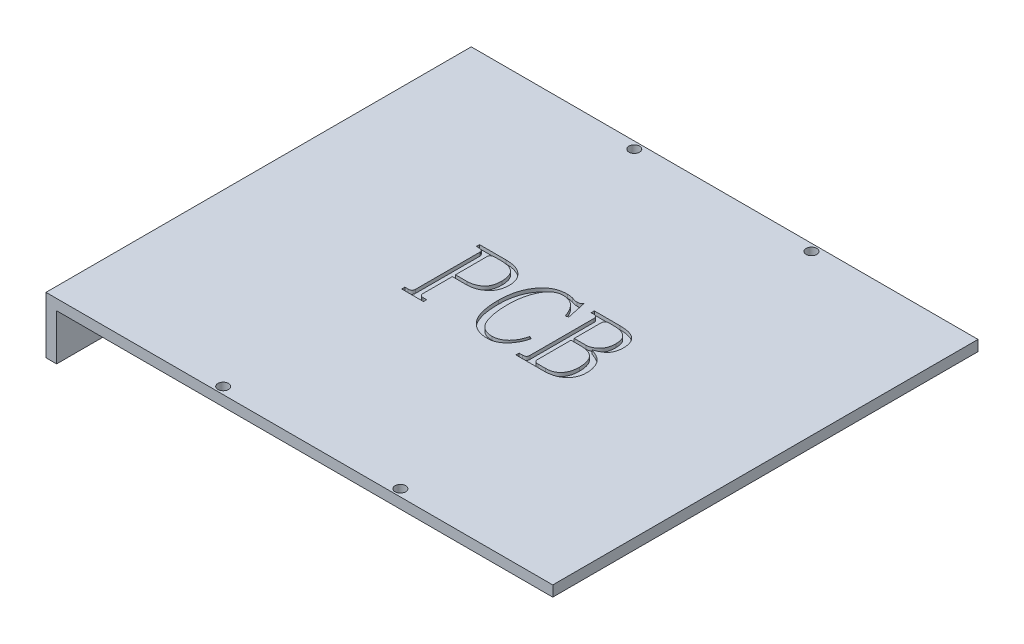
from build123d import *

# Parameters (mm, degrees)
SKETCH_1_W          = 140
SKETCH_1_H          = 120
SKETCH_1_R          = 1.5
EXTRUDE_1_DEPTH     = 3
SKETCH_2_W          = 3
SKETCH_2_H          = 120
EXTRUDE_2_DEPTH     = 16
SKETCH_3_W          = 16
SKETCH_3_H          = 1
CUT_EXTRUDE_1_DEPTH = 13
SKETCH_4_W          = 13
SKETCH_4_H          = 6.8
CUT_EXTRUDE_2_DEPTH = 13
CUT_EXTRUDE_3_DEPTH = 1


with BuildPart() as part:
    # 草图1 → 凸台-拉伸1 (new body)
    with BuildSketch(Plane(origin=(0, 0, 0), x_dir=(1, 0, 0), z_dir=(0, 1, 0))):
        with Locations((70, 60)):
            Rectangle(SKETCH_1_W, SKETCH_1_H)
        with Locations(Location((45, 118, 0), (0, 0, 270))):
            Circle(SKETCH_1_R, mode=Mode.SUBTRACT)
        with Locations(Location((95, 118, 0), (0, 0, 270))):
            Circle(SKETCH_1_R, mode=Mode.SUBTRACT)
        with Locations(Location((95, 2, 0), (0, 0, 270))):
            Circle(SKETCH_1_R, mode=Mode.SUBTRACT)
        with Locations(Location((45, 2, 0), (0, 0, 270))):
            Circle(SKETCH_1_R, mode=Mode.SUBTRACT)
    extrude(amount=EXTRUDE_1_DEPTH)

    # 草图2 → 凸台-拉伸2 (add)
    with BuildSketch(Plane(origin=(0, 3, 0), x_dir=(1, 0, 0), z_dir=(0, 1, 0))):
        with Locations((-1.5, 60)):
            Rectangle(SKETCH_2_W, SKETCH_2_H)
    extrude(amount=-EXTRUDE_2_DEPTH)

    # 草图3 → 切除-拉伸1 (cut)
    with BuildSketch(Plane.ZY.offset(3)):
        with Locations((-75, -2.75)):
            Rectangle(SKETCH_3_W, SKETCH_3_H)
    extrude(amount=-CUT_EXTRUDE_1_DEPTH, mode=Mode.SUBTRACT)

    # 草图4 → 切除-拉伸2 (cut)
    with BuildSketch(Plane(origin=(0, 0, 0), x_dir=(0, 0, -1), z_dir=(1, 0, 0))):
        with Locations((23.25, -3.4)):
            Rectangle(SKETCH_4_W, SKETCH_4_H)
    extrude(amount=-CUT_EXTRUDE_2_DEPTH, mode=Mode.SUBTRACT)

    # 草图5 → 切除-拉伸3 (cut)
    # profile 1 of 3: a face of its own
    with BuildSketch(Plane(origin=(0, 3, 0), x_dir=(1, 0, 0), z_dir=(0, 1, 0))):
        with BuildLine():
            Line((50.486114297, 61.171336776), (50.486114297, 52.901691817))
            add(Edge.make_bspline(
                [(50.486114297, 52.901691817), (50.488899739, 52.823361918), (50.494232978, 52.673384971), (50.556585686, 52.464291652), (50.65589332, 52.285718962), (50.795910233, 52.140372539), (50.971307938, 52.037503046), (51.166693275, 51.954004432), (51.387340451, 51.908587981), (51.54182874, 51.904147349), (51.621438436, 51.901859036)],
                knots=[0, 0, 0, 0, 1.092208976, 2.091234244, 3.017615395, 3.926167436, 4.874801088, 5.841260314, 6.887575164, 8, 8, 8, 8], degree=3))
            Line((51.621438436, 51.901859036), (52.504468321, 51.901859036))
            Line((52.504468321, 51.901859036), (52.504468321, 51.004812804))
            Line((52.504468321, 51.004812804), (46.374652397, 51.004812804))
            Line((46.374652397, 51.004812804), (46.374652397, 51.901859036))
            Line((46.374652397, 51.901859036), (47.257682282, 51.901859036))
            add(Edge.make_bspline(
                [(47.257682282, 51.901859036), (47.354651052, 51.903011756), (47.53618006, 51.905169689), (47.781917812, 51.959474942), (47.989534403, 52.028436602), (48.144069585, 52.147367755), (48.263043117, 52.294057907), (48.33885493, 52.473983515), (48.388197955, 52.682572659), (48.391327571, 52.831269297), (48.393006421, 52.911036048)],
                knots=[0, 0, 0, 0, 1.319183227, 2.469558204, 3.424729584, 4.274820955, 5.091307053, 5.976025123, 6.91425992, 8, 8, 8, 8], degree=3))
            Line((48.393006421, 52.911036048), (48.393006421, 70.926714559))
            add(Edge.make_bspline(
                [(48.393006421, 70.926714559), (48.391067751, 71.006403258), (48.387416809, 71.156474567), (48.340829589, 71.366081383), (48.261552973, 71.544472008), (48.144358249, 71.690830839), (47.988453884, 71.808049487), (47.783743514, 71.885838862), (47.535290934, 71.930211), (47.35444695, 71.933911523), (47.257682282, 71.935891571)],
                knots=[0, 0, 0, 0, 1.085062371, 2.043410581, 2.908232547, 3.724209003, 4.573769755, 5.53611061, 6.681640195, 8, 8, 8, 8], degree=3))
            Line((47.257682282, 71.935891571), (46.500799523, 71.935891571))
            Line((46.500799523, 71.935891571), (46.500799523, 72.832937804))
            Line((46.500799523, 72.832937804), (54.013561723, 72.832937804))
            add(Edge.make_bspline(
                [(54.013561723, 72.832937804), (54.272275324, 72.82906905), (54.775282014, 72.821547183), (55.506442184, 72.745701893), (56.192748638, 72.620729369), (56.832409015, 72.444158243), (57.427670095, 72.219036264), (57.977103335, 71.943848555), (58.47896781, 71.614630425), (58.934385595, 71.241084289), (59.333132327, 70.824127155), (59.686020999, 70.383805662), (59.988644855, 69.919209756), (60.233206624, 69.425273486), (60.419671999, 68.902505871), (60.555706457, 68.354981729), (60.635872368, 67.781628821), (60.646990962, 67.391729847), (60.65263827, 67.193694038)],
                knots=[0, 0, 0, 0, 1.264777466, 2.459057138, 3.589800812, 4.672541614, 5.699389361, 6.697305997, 7.671072234, 8.628621912, 9.571153625, 10.486969733, 11.384749149, 12.277085464, 13.175639775, 14.093638171, 15.0317289, 16, 16, 16, 16], degree=3))
            add(Edge.make_bspline(
                [(60.65263827, 67.193694038), (60.647999247, 66.955104786), (60.638959624, 66.490188668), (60.547447814, 65.816139383), (60.405063721, 65.186218568), (60.201333449, 64.600986983), (59.946809633, 64.055548278), (59.625818961, 63.557682086), (59.248449446, 63.103378912), (58.813810871, 62.701067523), (58.342428727, 62.345317876), (57.850693778, 62.02576978), (57.329774508, 61.769687005), (56.794342856, 61.543291354), (56.233057514, 61.376657126), (55.649200752, 61.262530674), (55.045178244, 61.182559488), (54.633663502, 61.175116245), (54.424707914, 61.171336776)],
                knots=[0, 0, 0, 0, 1.172847683, 2.285416408, 3.338936027, 4.344237019, 5.327587366, 6.292233631, 7.249430779, 8.224903534, 9.197726197, 10.151792131, 11.104103785, 12.048620631, 13.008266484, 13.977191253, 14.972874725, 16, 16, 16, 16], degree=3))
            Line((54.424707914, 61.171336776), (50.486114297, 61.171336776))
        make_face()
        with BuildLine():
            add(Edge.make_bspline(
                [(53.691185734, 62.068383009), (53.848591244, 62.072413017), (54.161113201, 62.080414426), (54.622558194, 62.130846645), (55.068689323, 62.221743373), (55.501226055, 62.341350908), (55.918150961, 62.503958726), (56.325734302, 62.691991398), (56.713407241, 62.925457514), (57.090723429, 63.183456351), (57.437354499, 63.490268854), (57.74085617, 63.852190841), (57.998158412, 64.263805958), (58.202371622, 64.729381765), (58.368508802, 65.240428371), (58.474571242, 65.804184543), (58.548249851, 66.416179507), (58.555668511, 66.841479346), (58.559530393, 67.062874795)],
                knots=[0, 0, 0, 0, 0.952352205, 1.890854861, 2.803655993, 3.704415787, 4.602065843, 5.508229753, 6.416350822, 7.336416894, 8.270653392, 9.20678836, 10.184528812, 11.196664642, 12.275290871, 13.428302826, 14.661269065, 16, 16, 16, 16], degree=3))
            add(Edge.make_bspline(
                [(58.559530393, 67.062874795), (58.555978136, 67.263878861), (58.549079181, 67.654255513), (58.494976899, 68.22040639), (58.39474757, 68.744429898), (58.267883744, 69.229885003), (58.093791444, 69.671308712), (57.882119145, 70.072382825), (57.634715311, 70.434820245), (57.345486269, 70.756422724), (57.016465831, 71.041261118), (56.636663824, 71.277368505), (56.217305401, 71.486504109), (55.749740745, 71.652884866), (55.233974073, 71.77705877), (54.675072883, 71.86962099), (54.069222469, 71.926130519), (53.650819883, 71.932562061), (53.434219365, 71.935891571)],
                knots=[0, 0, 0, 0, 1.180961537, 2.293584514, 3.336282026, 4.312971279, 5.23733707, 6.117388852, 6.972737908, 7.808630604, 8.652250519, 9.520376474, 10.428844692, 11.401367291, 12.428898221, 13.542085457, 14.727575834, 16, 16, 16, 16], degree=3))
            Line((53.434219365, 71.935891571), (51.640126899, 71.935891571))
            add(Edge.make_bspline(
                [(51.640126899, 71.935891571), (51.558926093, 71.933659229), (51.401288457, 71.929325515), (51.176574668, 71.883104461), (50.975253632, 71.802590319), (50.801848801, 71.690548731), (50.657025625, 71.550068955), (50.555594055, 71.372328045), (50.494406424, 71.164314654), (50.488959247, 71.014371198), (50.486114297, 70.93605879)],
                knots=[0, 0, 0, 0, 1.124149048, 2.18234533, 3.160243143, 4.112071858, 5.027733987, 5.92722931, 6.917434162, 8, 8, 8, 8], degree=3))
            Line((50.486114297, 70.93605879), (50.486114297, 62.068383009))
            Line((50.486114297, 62.068383009), (53.691185734, 62.068383009))
        make_face(mode=Mode.SUBTRACT)
    # profile 2 of 3: a face of its own
    with BuildSketch(Plane(origin=(0, 3, 0), x_dir=(1, 0, 0), z_dir=(0, 1, 0))):
        with BuildLine():
            add(Edge.make_bspline(
                [(70.468753558, 51.004812804), (70.18013046, 51.012376075), (69.615581429, 51.027169893), (68.79353186, 51.157916573), (68.015303077, 51.361906548), (67.282155877, 51.652800119), (66.594661712, 52.029165395), (65.956238691, 52.49103757), (65.363410083, 53.034374083), (64.813740812, 53.657546701), (64.319333807, 54.373637416), (63.894653983, 55.186833827), (63.54284641, 56.096024162), (63.248683339, 57.094447155), (63.021853774, 58.188395268), (62.86184132, 59.376453596), (62.76284529, 60.658837711), (62.751573199, 61.544918312), (62.745746147, 62.002973388)],
                knots=[0, 0, 0, 0, 0.91019159, 1.780341849, 2.619509982, 3.444442211, 4.262554757, 5.086315207, 5.924619583, 6.795102808, 7.702943319, 8.663529413, 9.682843947, 10.774381161, 11.944421959, 13.204408569, 14.554832549, 16, 16, 16, 16], degree=3))
            add(Edge.make_bspline(
                [(62.745746147, 62.002973388), (62.750780063, 62.395725408), (62.760628294, 63.164095798), (62.874325809, 64.290423829), (63.042572841, 65.366881878), (63.286658486, 66.390940456), (63.593760546, 67.366041001), (63.977648856, 68.285741188), (64.428777896, 69.156566576), (64.94290384, 69.970345113), (65.516013455, 70.711712728), (66.148299308, 71.358529024), (66.826978201, 71.91152097), (67.562602309, 72.357452339), (68.345540581, 72.707245378), (69.177650131, 72.955182704), (70.06022613, 73.10173242), (70.664424874, 73.121729187), (70.973342064, 73.131953215)],
                knots=[0, 0, 0, 0, 1.217065952, 2.381037892, 3.505699821, 4.592375904, 5.641290396, 6.671461153, 7.677688211, 8.678165985, 9.65161621, 10.57679781, 11.476292107, 12.358083012, 13.235515115, 14.127515664, 15.042628598, 16, 16, 16, 16], degree=3))
            add(Edge.make_bspline(
                [(70.973342064, 73.131953215), (71.270498741, 73.12110568), (71.869990103, 73.09922159), (72.454145563, 72.96258413), (72.748746066, 72.893675309)],
                knots=[0, 0, 0, 0, 0.991362666, 2, 2, 2, 2], degree=3))
            add(Edge.make_bspline(
                [(72.748746066, 72.893675309), (72.89123967, 72.838461148), (73.160652382, 72.734067713), (73.557205038, 72.619711044), (73.922147162, 72.550654454), (74.156360269, 72.539296619), (74.2671837, 72.533922393)],
                knots=[0, 0, 0, 0, 1.168106689, 2.208539777, 3.152328528, 4, 4, 4, 4], degree=3))
            add(Edge.make_bspline(
                [(74.2671837, 72.533922393), (74.420152921, 72.538128778), (74.698199009, 72.545774559), (75.089447701, 72.629222634), (75.42130784, 72.825877394), (75.576905927, 73.025841867), (75.659474207, 73.131953215)],
                knots=[0, 0, 0, 0, 1.155203278, 2.099767206, 2.991639568, 4, 4, 4, 4], degree=3))
            Line((75.659474207, 73.131953215), (76.799470462, 67.749675817))
            Line((76.799470462, 67.749675817), (76.042587703, 67.450660406))
            add(Edge.make_bspline(
                [(76.042587703, 67.450660406), (75.979023651, 67.639756211), (75.854451931, 68.010342873), (75.640522292, 68.542909917), (75.403870904, 69.037478702), (75.164472839, 69.502845038), (74.901028736, 69.930009632), (74.620243144, 70.322217987), (74.327466296, 70.683324646), (74.01606608, 71.007597816), (73.690332896, 71.302728824), (73.332325783, 71.547757671), (72.955534928, 71.762486262), (72.553366924, 71.933144938), (72.128399156, 72.070686893), (71.679481695, 72.16850348), (71.205265843, 72.224463008), (70.881605515, 72.23137724), (70.716375695, 72.234906982)],
                knots=[0, 0, 0, 0, 1.2365545, 2.423377946, 3.554879843, 4.634490077, 5.666065877, 6.662669017, 7.623172335, 8.54500294, 9.447779385, 10.342310178, 11.228466009, 12.13232588, 13.045215339, 13.993953262, 14.975905564, 16, 16, 16, 16], degree=3))
            add(Edge.make_bspline(
                [(70.716375695, 72.234906982), (70.500724517, 72.225889589), (70.075953193, 72.208127897), (69.459494804, 72.068800885), (68.879587642, 71.843161052), (68.340292625, 71.518339969), (67.840138466, 71.104159238), (67.377244212, 70.600995011), (66.956440838, 70.006281039), (66.580027733, 69.32655574), (66.24381764, 68.584393361), (65.94737521, 67.79297125), (65.697116462, 66.959334799), (65.490720946, 66.081022184), (65.333279259, 65.161861595), (65.222961802, 64.197866261), (65.150485491, 63.192356315), (65.142122467, 62.506133286), (65.137869434, 62.157153209)],
                knots=[0, 0, 0, 0, 0.813049281, 1.601475224, 2.371869771, 3.151885715, 3.965974851, 4.81427469, 5.724164691, 6.70815208, 7.741587796, 8.795929177, 9.894600034, 11.023467957, 12.198204385, 13.411063689, 14.683391327, 16, 16, 16, 16], degree=3))
            add(Edge.make_bspline(
                [(65.137869434, 62.157153209), (65.140741877, 61.77861197), (65.146325263, 61.042812497), (65.210005645, 59.970643095), (65.304044531, 58.961481801), (65.445047784, 58.015190818), (65.621525, 57.130718013), (65.833434498, 56.306937251), (66.090100528, 55.547529374), (66.386880966, 54.852695811), (66.729804991, 54.229568772), (67.123066571, 53.68258955), (67.575660533, 53.226288937), (68.078324446, 52.848911309), (68.634971245, 52.559882908), (69.240756898, 52.344740656), (69.900298985, 52.225193462), (70.356162755, 52.209124927), (70.590228568, 52.200874447)],
                knots=[0, 0, 0, 0, 1.426677095, 2.773141061, 4.047105211, 5.245912681, 6.377603137, 7.445482251, 8.449784712, 9.396342773, 10.289806112, 11.125804167, 11.926944738, 12.703002465, 13.485494377, 14.28197586, 15.117870857, 16, 16, 16, 16], degree=3))
            add(Edge.make_bspline(
                [(70.590228568, 52.200874447), (70.757045365, 52.205700647), (71.084199728, 52.215165593), (71.567318105, 52.279996904), (72.030813273, 52.39996854), (72.479066785, 52.557026138), (72.908778346, 52.759461272), (73.317595401, 53.010435972), (73.711218616, 53.304968868), (74.082671551, 53.646798508), (74.431833375, 54.022818519), (74.749941024, 54.432270902), (75.041950525, 54.868630935), (75.301999414, 55.336819051), (75.53726812, 55.832146446), (75.736997595, 56.359445529), (75.912077548, 56.914160411), (75.998636406, 57.298983245), (76.042587703, 57.494381645)],
                knots=[0, 0, 0, 0, 0.969721456, 1.901778546, 2.826154081, 3.748132671, 4.659291955, 5.58153718, 6.532095748, 7.512533613, 8.511889485, 9.511532347, 10.523398227, 11.560977176, 12.621987777, 13.708076351, 14.836248333, 16, 16, 16, 16], degree=3))
            Line((76.042587703, 57.494381645), (76.799470462, 57.111268149))
            add(Edge.make_bspline(
                [(76.799470462, 57.111268149), (76.745068412, 56.892311208), (76.637917416, 56.461050727), (76.42369118, 55.838227613), (76.181392071, 55.243380452), (75.906631097, 54.677456889), (75.596258554, 54.142706621), (75.254967237, 53.635263232), (74.876456347, 53.159194966), (74.466987889, 52.717541584), (74.034315969, 52.313676629), (73.576959883, 51.963927666), (73.103479337, 51.667110198), (72.611953834, 51.425620345), (72.101110921, 51.239020893), (71.57248636, 51.102706551), (71.025677552, 51.021649892), (70.655906253, 51.010470858), (70.468753558, 51.004812804)],
                knots=[0, 0, 0, 0, 1.139091483, 2.243569613, 3.323086643, 4.382030189, 5.4182324, 6.443659459, 7.468241352, 8.486887453, 9.483300959, 10.454046576, 11.390432054, 12.301597947, 13.214934416, 14.132630349, 15.054866446, 16, 16, 16, 16], degree=3))
        make_face()
    # profile 3 of 3: a face of its own
    with BuildSketch(Plane(origin=(0, 3, 0), x_dir=(1, 0, 0), z_dir=(0, 1, 0))):
        with BuildLine():
            Line((78.593562927, 51.004812804), (78.593562927, 51.901859036))
            Line((78.593562927, 51.901859036), (79.57937936, 51.901859036))
            add(Edge.make_bspline(
                [(79.57937936, 51.901859036), (79.674828665, 51.902838352), (79.851816412, 51.904654256), (80.091147391, 51.960069773), (80.29283287, 52.028460029), (80.443058255, 52.147479761), (80.556146042, 52.295625033), (80.632795781, 52.47378489), (80.681778448, 52.68263293), (80.684962664, 52.831290341), (80.686670804, 52.911036048)],
                knots=[0, 0, 0, 0, 1.31649398, 2.441121023, 3.389821834, 4.234908784, 5.049764237, 5.947118113, 6.898753058, 8, 8, 8, 8], degree=3))
            Line((80.686670804, 52.911036048), (80.686670804, 70.926714559))
            add(Edge.make_bspline(
                [(80.686670804, 70.926714559), (80.684834772, 71.006433633), (80.68137712, 71.156562145), (80.633653171, 71.36516813), (80.559711239, 71.542503747), (80.452996659, 71.690426932), (80.306139674, 71.808033483), (80.111832683, 71.885270857), (79.875832902, 71.930443954), (79.704203335, 71.933988889), (79.612084171, 71.935891571)],
                knots=[0, 0, 0, 0, 1.117684408, 2.104845037, 2.986757787, 3.80065017, 4.641158685, 5.59201505, 6.707556245, 8, 8, 8, 8], degree=3))
            Line((79.612084171, 71.935891571), (78.892578338, 71.935891571))
            Line((78.892578338, 71.935891571), (78.892578338, 72.832937804))
            Line((78.892578338, 72.832937804), (86.162390517, 72.832937804))
            add(Edge.make_bspline(
                [(86.162390517, 72.832937804), (86.405457352, 72.829613428), (86.875149574, 72.823189543), (87.553976885, 72.766714726), (88.183373839, 72.674776426), (88.764500289, 72.544120586), (89.300041557, 72.379651326), (89.783046489, 72.166091747), (90.221326544, 71.925410757), (90.610515007, 71.642492749), (90.947823294, 71.315854147), (91.24850094, 70.95412786), (91.493048937, 70.543365609), (91.702992529, 70.095592582), (91.858857263, 69.603518729), (91.971061831, 69.071490259), (92.035621876, 68.498801222), (92.044613652, 68.103362392), (92.049256421, 67.899183523)],
                knots=[0, 0, 0, 0, 1.321190763, 2.553013972, 3.700076878, 4.776341066, 5.788490682, 6.740121828, 7.642219434, 8.502464537, 9.346771954, 10.189081914, 11.051573852, 11.937960693, 12.872375438, 13.850417427, 14.890095493, 16, 16, 16, 16], degree=3))
            add(Edge.make_bspline(
                [(92.049256421, 67.899183523), (92.04162108, 67.616582391), (92.026955741, 67.073785219), (91.878338492, 66.298448228), (91.643186294, 65.60018359), (91.361047957, 65.075443464), (91.073275411, 64.694322903), (90.797015942, 64.426661086), (90.479067098, 64.158237704), (90.106543944, 63.900700062), (89.679268782, 63.655655247), (89.203805766, 63.413720043), (88.677500683, 63.177750365), (88.30462295, 63.038081119), (88.110662804, 62.965429242)],
                knots=[0, 0, 0, 0, 1.478915114, 2.840579352, 4.117694961, 5.32615159, 5.942958129, 6.612142595, 7.336033275, 8.121357524, 8.980506808, 9.914558854, 10.915214204, 12, 12, 12, 12], degree=3))
            add(Edge.make_bspline(
                [(88.110662804, 62.965429242), (88.339080576, 62.88885084), (88.782002359, 62.740358705), (89.409293869, 62.477594379), (89.980312488, 62.194289448), (90.494401001, 61.887315752), (90.943270483, 61.548136265), (91.341643126, 61.192584907), (91.680797553, 60.809402676), (92.044605985, 60.263465895), (92.403993553, 59.540441457), (92.721569779, 58.625819428), (92.913699654, 57.659679347), (92.935324099, 56.998447209), (92.946302653, 56.662745033)],
                knots=[0, 0, 0, 0, 1.004828066, 1.94844839, 2.834692256, 3.662617835, 4.442303682, 5.178316844, 5.887335754, 6.57033393, 7.909882347, 9.243429455, 10.600511564, 12, 12, 12, 12], degree=3))
            add(Edge.make_bspline(
                [(92.946302653, 56.662745033), (92.94060384, 56.453850465), (92.929461194, 56.045407817), (92.851339051, 55.446317865), (92.708417499, 54.882948125), (92.523609056, 54.345906405), (92.2727942, 53.846395271), (91.97308966, 53.374591225), (91.614646137, 52.937937121), (91.203974684, 52.537104544), (90.745796547, 52.177965906), (90.247714171, 51.864120882), (89.712340655, 51.594107759), (89.133540566, 51.383815318), (88.521530204, 51.20563834), (87.866059169, 51.095512862), (87.175102034, 51.015547748), (86.699938803, 51.00844714), (86.456733812, 51.004812804)],
                knots=[0, 0, 0, 0, 1.03220486, 2.018226176, 2.977550947, 3.899993758, 4.818866743, 5.732504679, 6.656743251, 7.603610545, 8.562688369, 9.527675464, 10.508488064, 11.519037997, 12.56656177, 13.653372921, 14.798915025, 16, 16, 16, 16], degree=3))
            Line((86.456733812, 51.004812804), (78.593562927, 51.004812804))
        make_face()
        with BuildLine():
            add(Edge.make_bspline(
                [(86.110997244, 51.901859036), (86.281011589, 51.904356068), (86.613049888, 51.909232776), (87.095745843, 51.979037465), (87.551769415, 52.079324897), (87.97888513, 52.22335155), (88.37350917, 52.413341127), (88.743764612, 52.637129496), (89.078656801, 52.911662827), (89.390847251, 53.220062783), (89.663193494, 53.570836778), (89.905627329, 53.952753112), (90.105793694, 54.370540037), (90.267609157, 54.822177821), (90.402069627, 55.305402539), (90.48487413, 55.824251922), (90.544962609, 56.374789422), (90.551044872, 56.752889975), (90.554179366, 56.947744096)],
                knots=[0, 0, 0, 0, 1.068538249, 2.086856968, 3.06125264, 4.00304318, 4.914487128, 5.811710448, 6.717450553, 7.631838042, 8.566673474, 9.504379022, 10.472698401, 11.47371756, 12.519377308, 13.622605157, 14.774809559, 16, 16, 16, 16], degree=3))
            add(Edge.make_bspline(
                [(90.554179366, 56.947744096), (90.550663749, 57.170548378), (90.543841888, 57.602887838), (90.489384583, 58.229459677), (90.390413343, 58.811701378), (90.258121198, 59.34888641), (90.083281888, 59.839744236), (89.875449305, 60.287384269), (89.620001691, 60.687437487), (89.32865247, 61.045074056), (89.000572541, 61.363240717), (88.6261843, 61.626991315), (88.221693106, 61.86081421), (87.773797942, 62.046803913), (87.287948557, 62.190413987), (86.763680014, 62.291262114), (86.203151664, 62.360106008), (85.815317782, 62.364920871), (85.615752969, 62.36739842)],
                knots=[0, 0, 0, 0, 1.269369145, 2.463141042, 3.579089459, 4.631456819, 5.610935144, 6.54368073, 7.437238127, 8.307539361, 9.167328061, 10.031728879, 10.910000029, 11.824632326, 12.78757271, 13.79166089, 14.86367127, 16, 16, 16, 16], degree=3))
            Line((85.615752969, 62.36739842), (82.779778681, 62.36739842))
            Line((82.779778681, 62.36739842), (82.779778681, 52.911036048))
            add(Edge.make_bspline(
                [(82.779778681, 52.911036048), (82.781981156, 52.830933184), (82.786117689, 52.680489608), (82.85376354, 52.473170635), (82.942083768, 52.289168544), (83.086454345, 52.147904591), (83.252385897, 52.034914233), (83.448397293, 51.961835163), (83.66128842, 51.906423172), (83.813469486, 51.903409228), (83.89174224, 51.901859036)],
                knots=[0, 0, 0, 0, 1.122838612, 2.108836666, 3.051368301, 3.967198295, 4.916858849, 5.862452317, 6.900574495, 8, 8, 8, 8], degree=3))
            Line((83.89174224, 51.901859036), (86.110997244, 51.901859036))
        make_face(mode=Mode.SUBTRACT)
        with BuildLine():
            add(Edge.make_bspline(
                [(89.956148544, 67.847790249), (89.953326282, 68.027093457), (89.947884723, 68.37280509), (89.884820091, 68.871362414), (89.788790506, 69.330129396), (89.654619671, 69.749988571), (89.476987694, 70.128160223), (89.253899317, 70.462499569), (88.996991347, 70.760464507), (88.69727972, 71.013257414), (88.370174372, 71.232072375), (88.016994475, 71.419232187), (87.642939368, 71.577180306), (87.24517692, 71.710784638), (86.822569242, 71.81037986), (86.376551353, 71.886929567), (85.907760434, 71.927905399), (85.587792414, 71.933189743), (85.424196222, 71.935891571)],
                knots=[0, 0, 0, 0, 1.230522642, 2.37255093, 3.444327323, 4.445319863, 5.3924246, 6.302962904, 7.197281024, 8.084602901, 8.98624353, 9.895210584, 10.824765798, 11.77162902, 12.772792909, 13.803004905, 14.876700136, 16, 16, 16, 16], degree=3))
            Line((85.424196222, 71.935891571), (83.915102819, 71.935891571))
            add(Edge.make_bspline(
                [(83.915102819, 71.935891571), (83.835494311, 71.933602538), (83.681008325, 71.929160507), (83.460345069, 71.883753815), (83.265015274, 71.800221491), (83.089419923, 71.697471958), (82.951057482, 71.552683066), (82.850031076, 71.378546634), (82.787494504, 71.172236815), (82.782443369, 71.02374092), (82.779778681, 70.945403022)],
                knots=[0, 0, 0, 0, 1.117977861, 2.169515726, 3.140799342, 4.094168402, 5.007255772, 5.919293615, 6.902338914, 8, 8, 8, 8], degree=3))
            Line((82.779778681, 70.945403022), (82.779778681, 63.264444653))
            Line((82.779778681, 63.264444653), (86.054931854, 63.264444653))
            add(Edge.make_bspline(
                [(86.054931854, 63.264444653), (86.283949118, 63.278002845), (86.746890758, 63.305409739), (87.426075156, 63.531744421), (88.087128418, 63.883523871), (88.6094358, 64.281672934), (88.996820845, 64.67014081), (89.256328486, 65.010713127), (89.474672475, 65.389524007), (89.654966095, 65.806070496), (89.788502662, 66.263247816), (89.884279595, 66.757555079), (89.947878478, 67.290171943), (89.953327765, 67.657596147), (89.956148544, 67.847790249)],
                knots=[0, 0, 0, 0, 1.2219951, 2.470173672, 3.788629745, 5.214103613, 5.961823135, 6.716188364, 7.495904157, 8.29398526, 9.136928761, 10.036637988, 10.983681881, 12, 12, 12, 12], degree=3))
        make_face(mode=Mode.SUBTRACT)
    extrude(amount=-CUT_EXTRUDE_3_DEPTH, mode=Mode.SUBTRACT)


solid = part.part
